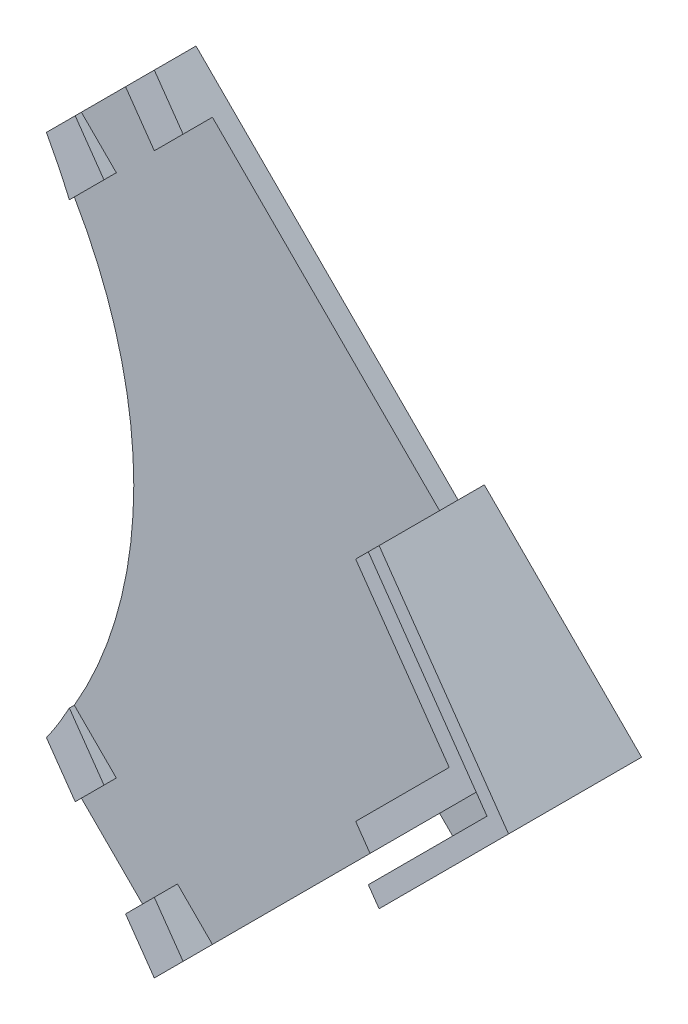
from build123d import *

# Parameters (mm, degrees)
CLOSED_BOTTOM_PLATE_3MM_DEPTH   = 3
FOOT1_CURVED_R70P71_DEPTH       = 20
FOOT2_CURVED_R70P71_DEPTH       = 20
PAD4_C_BLANK_DEPTH              = 20
PAD5_A_BLANK_DEPTH              = 20
SLOT_BACKING_INSIDE_NORTH_DEPTH = 22
SLOT_BACKING_INSIDE_EAST_DEPTH  = 22
TOP_OUTER_PLANE_DEPTH           = 157.633329786
TOP_OUTER_PLANE_DEPTH_BACK      = 157.633329786
SLOT_BASE_NORTH_DEPTH           = 3
SLOT_BASE_EAST_DEPTH            = 3
SLOT_OUTER_NORTH_DEPTH          = 22
SLOT_OUTER_EAST_DEPTH           = 22
CUT_EXTRUDE_2_DEPTH             = 165.335023656
CUT_EXTRUDE_2_DEPTH_BACK        = 165.335023656


with BuildPart() as part:
    # Closed_bottom_plate_3mm_sketch → Closed_bottom_plate_3mm (new body)
    with BuildSketch(Plane.XY):
        with BuildLine():
            Line((77.781745931, -63.639610307), (141.421356237, 0))
            Line((141.421356237, 0), (77.781745931, 63.639610307))
            Line((77.781745931, 63.639610307), (56.568542495, 42.426406871))
            ThreePointArc((56.568542495, 42.426406871), (70.710678119, 0), (56.568542495, -42.426406871))
            Line((56.568542495, -42.426406871), (77.781745931, -63.639610307))
        make_face()
    extrude(amount=CLOSED_BOTTOM_PLATE_3MM_DEPTH)

    # Foot1_curved_R70p71_sketch → Foot1_curved_R70p71 (add)
    with BuildSketch(Plane.XY):
        with BuildLine():
            Line((62.225396744, 48.083261121), (67.882250994, 42.426406871))
            Line((67.882250994, 42.426406871), (61.080791676, 35.624947554))
            ThreePointArc((61.080791676, 35.624947554), (58.922885367, 39.090837546), (56.568542495, 42.426406871))
            Line((56.568542495, 42.426406871), (62.225396744, 48.083261121))
        make_face()
    extrude(amount=FOOT1_CURVED_R70P71_DEPTH)

    # Foot2_curved_R70p71_sketch → Foot2_curved_R70p71 (add)
    with BuildSketch(Plane.XY):
        with BuildLine():
            Line((62.225396744, -48.083261121), (67.882250994, -42.426406871))
            Line((67.882250994, -42.426406871), (61.080791676, -35.624947554))
            ThreePointArc((61.080791676, -35.624947554), (58.922885367, -39.090837546), (56.568542495, -42.426406871))
            Line((56.568542495, -42.426406871), (62.225396744, -48.083261121))
        make_face()
    extrude(amount=FOOT2_CURVED_R70P71_DEPTH)

    # Pad4_C_blank_sketch → Pad4_C_blank (add)
    with BuildSketch(Plane.XY):
        Polygon((72.124891681, 57.982756057), (77.781745931, 52.325901808), (83.43860018, 57.982756057), (77.781745931, 63.639610307), align=None)
    extrude(amount=PAD4_C_BLANK_DEPTH)

    # Pad5_A_blank_sketch → Pad5_A_blank (add)
    with BuildSketch(Plane.XY):
        Polygon((72.124891681, -57.982756057), (77.781745931, -63.639610307), (83.43860018, -57.982756057), (77.781745931, -52.325901808), align=None)
    extrude(amount=PAD5_A_BLANK_DEPTH)

    # Slot_backing_inside_north_sketch → Slot_backing_inside_north (add)
    with BuildSketch(Plane.XY):
        Polygon((117.379725677, 18.384776311), (138.592929113, -2.828427125), (141.421356237, 0), (120.208152802, 21.213203436), align=None)
    extrude(amount=SLOT_BACKING_INSIDE_NORTH_DEPTH)

    # Slot_backing_inside_east_sketch → Slot_backing_inside_east (add)
    with BuildSketch(Plane.XY):
        Polygon((117.379725677, -18.384776311), (120.208152802, -21.213203436), (141.421356237, 0), (138.592929113, 2.828427125), align=None)
    extrude(amount=SLOT_BACKING_INSIDE_EAST_DEPTH)

    # Top_outer_plane_sketch → Top_outer_plane (cut, two sides: drawn at the far end of the back side and taken through both)
    with BuildSketch(Plane(origin=(0, 0, 0), x_dir=(1, 0, 0), z_dir=(0, 1, 0)).offset(-TOP_OUTER_PLANE_DEPTH_BACK)):
        Polygon((-100, 24.67766953), (250, -37.194173824), (250, -100), (-100, -100), align=None)
    extrude(amount=TOP_OUTER_PLANE_DEPTH + TOP_OUTER_PLANE_DEPTH_BACK, mode=Mode.SUBTRACT)

    # Slot_base_north_sketch → Slot_base_north (add)
    with BuildSketch(Plane.XY):
        Polygon((117.379725677, 18.384776311), (142.8355698, -7.071067812), (149.906637612, 0), (124.450793489, 25.455844123), align=None)
    extrude(amount=SLOT_BASE_NORTH_DEPTH)

    # Slot_base_east_sketch → Slot_base_east (add)
    with BuildSketch(Plane.XY):
        Polygon((117.379725677, -18.384776311), (124.450793489, -25.455844123), (149.906637612, 0), (142.8355698, 7.071067812), align=None)
    extrude(amount=SLOT_BASE_EAST_DEPTH)

    # Slot_outer_north_sketch → Slot_outer_north (add)
    with BuildSketch(Plane.XY):
        Polygon((122.329473145, 23.334523779), (147.785317268, -2.121320344), (149.906637612, 0), (124.450793489, 25.455844123), align=None)
    extrude(amount=SLOT_OUTER_NORTH_DEPTH)

    # Slot_outer_east_sketch → Slot_outer_east (add)
    with BuildSketch(Plane.XY):
        Polygon((122.329473145, -23.334523779), (124.450793489, -25.455844123), (149.906637612, 0), (147.785317268, 2.121320344), align=None)
    extrude(amount=SLOT_OUTER_EAST_DEPTH)

    # 草图13 → 切除-拉伸2 (cut, two sides: drawn at the far end of the back side and taken through both)
    with BuildSketch(Plane(origin=(0, 0, 0), x_dir=(1, 0, 0), z_dir=(0, 1, 0)).offset(-CUT_EXTRUDE_2_DEPTH_BACK)):
        Polygon((-100, 22.646659929), (250, -39.225183425), (250, -100), (-100, -100), align=None)
    extrude(amount=CUT_EXTRUDE_2_DEPTH + CUT_EXTRUDE_2_DEPTH_BACK, mode=Mode.SUBTRACT)


solid = part.part
